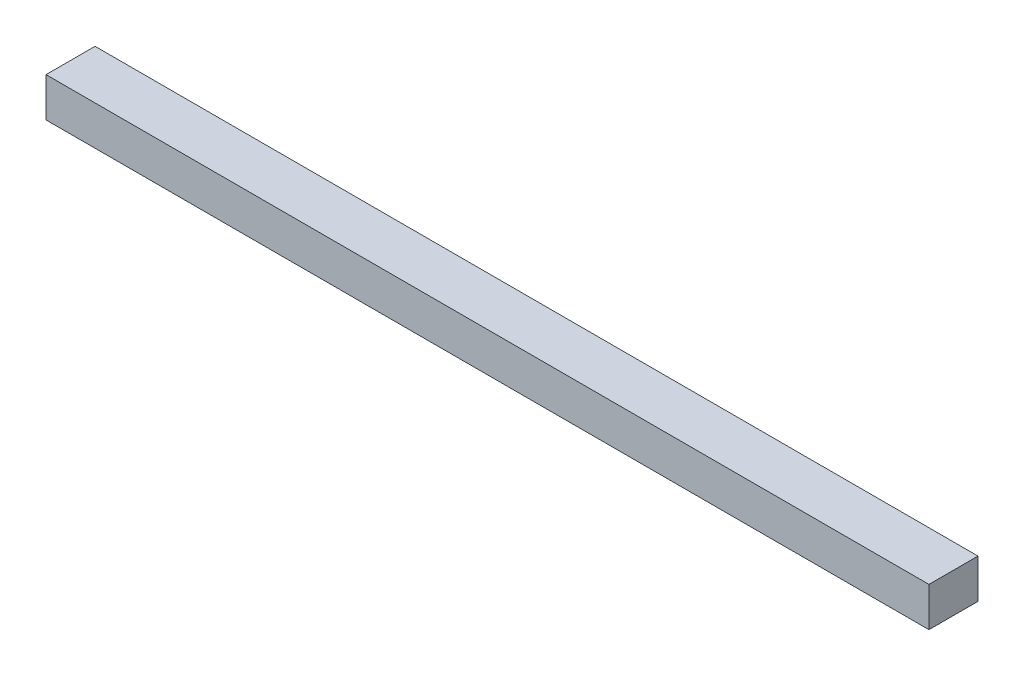
from build123d import *

# Parameters (mm, degrees)
SKETCH_1_W      = 180
SKETCH_1_H      = 10
EXTRUDE_1_DEPTH = 8


with BuildPart() as part:
    # 草图1 → 凸台-拉伸1 (new body)
    with BuildSketch(Plane(origin=(0, 0, 0), x_dir=(1, 0, 0), z_dir=(0, 1, 0))):
        with Locations((38.935828736, 25.972784626)):
            Rectangle(SKETCH_1_W, SKETCH_1_H)
    extrude(amount=EXTRUDE_1_DEPTH)


solid = part.part
